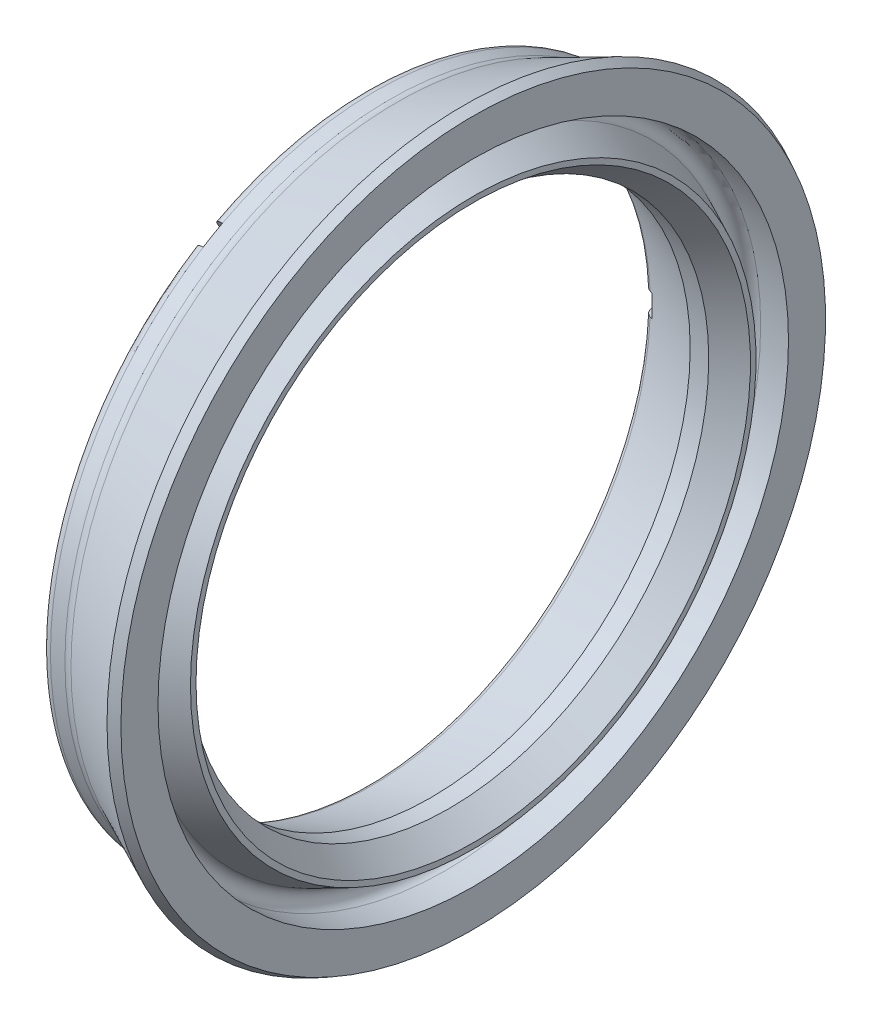
from build123d import *

# Parameters (mm, degrees)
FILLET1_R          = 1
CUT_EXTRUDE1_DEPTH = 0.1
SKETCH3_W          = 1
SKETCH3_H          = 1.2
CUT_EXTRUDE2_DEPTH = 28.834600908
CIRPATTERN1_COUNT  = 3


with BuildPart() as part:
    # Sketch1 → Revolve1 (revolve)
    with BuildSketch(Plane.XY, mode=Mode.PRIVATE) as revolve1_sk:
        with BuildLine():
            Line((0, 15.47657924), (0, 17))
            ThreePointArc((0, 17), (0.146446609, 17.353553391), (0.5, 17.5))
            Line((0.5, 17.5), (1.5, 17.5))
            Line((1.5, 17.5), (5.3, 19.25))
            Line((5.3, 19.25), (5.8, 19))
            Line((5.8, 19), (5.8, 17))
            Line((5.8, 17), (4.3, 17))
            ThreePointArc((4.3, 17), (3.811822126, 16.608084983), (4.088941212, 16.046729454))
            Line((4.088941212, 16.046729454), (5.8, 15.25))
            Line((5.8, 15.25), (5.8, 14.95))
            Line((5.8, 14.95), (4.5, 14))
            Line((4.5, 14), (3.5, 14))
            Line((3.5, 14), (0.348764329, 15))
            ThreePointArc((0.348764329, 15), (0.096504129, 15.181297879), (0, 15.47657924))
        make_face()
    revolve(revolve1_sk.sketch.rotate(Axis((0, 0, 0), (1, 0, 0)), 90), axis=Axis((0, 0, 0), (1, 0, 0)))

    # Fillet1
    fillet1_edges = [part.edges().sort_by_distance(p)[0] for p in [
        (1.5, 0, -17.5),
    ]]
    fillet(fillet1_edges, radius=FILLET1_R)

    # Sketch2 → Cut-Extrude1 (cut)
    # profile 1 of 13: a face of its own
    with BuildSketch(Plane.ZY):
        with BuildLine():
            Line((-5.513236692, 15.646736619), (-5.363557205, 15.696576363))
            add(Edge.make_bspline(
                [(-5.363557205, 15.696576363), (-5.353512255, 15.699826939), (-5.334289843, 15.70604737), (-5.30673904, 15.715099859), (-5.281364662, 15.72228272), (-5.258570361, 15.728853183), (-5.238105187, 15.733868692), (-5.220182011, 15.738282269), (-5.204518152, 15.740934727), (-5.1948641, 15.742169507), (-5.190480282, 15.742730209)],
                knots=[0, 0, 0, 0, 1.412503745, 2.703022838, 3.879057233, 4.940239887, 5.876218095, 6.697914565, 7.408734662, 8, 8, 8, 8], degree=3))
            add(Edge.make_bspline(
                [(-5.190480282, 15.742730209), (-5.184555288, 15.743203754), (-5.172822615, 15.744141467), (-5.155334297, 15.743794102), (-5.13832217, 15.741943867), (-5.121723228, 15.739167961), (-5.105588102, 15.734773302), (-5.089895179, 15.728996409), (-5.074596319, 15.721869467), (-5.059739804, 15.71362487), (-5.045598172, 15.704010342), (-5.032524099, 15.693098164), (-5.0203499, 15.681188019), (-5.009401397, 15.667970954), (-4.999722953, 15.653478799), (-4.990770581, 15.638031924), (-4.983107815, 15.621303853), (-4.97885988, 15.609588993), (-4.976698231, 15.603627645)],
                knots=[0, 0, 0, 0, 1.02975508, 2.039121114, 3.025811522, 3.993908284, 4.952930606, 5.919565219, 6.888900862, 7.875417496, 8.861543025, 9.847842398, 10.823348846, 11.809648219, 12.816292897, 13.840664528, 14.901177562, 16, 16, 16, 16], degree=3))
            add(Edge.make_bspline(
                [(-4.976698231, 15.603627645), (-4.973678409, 15.59359914), (-4.967765538, 15.573963128), (-4.964063446, 15.54390869), (-4.964249386, 15.514506201), (-4.968890484, 15.485953365), (-4.977814283, 15.458720436), (-4.990531553, 15.43294728), (-5.007870572, 15.40935199), (-5.025165341, 15.391139143), (-5.041252253, 15.377645777), (-5.054949222, 15.367674162), (-5.070219401, 15.358059909), (-5.087102374, 15.348865521), (-5.105305456, 15.339655945), (-5.125177032, 15.331087185), (-5.146454789, 15.322516357), (-5.161343337, 15.317346217), (-5.169005923, 15.314685337)],
                knots=[0, 0, 0, 0, 1.27216696, 2.490927996, 3.667247005, 4.839249893, 5.994210959, 7.142185145, 8.319939347, 9.542575186, 10.188263018, 10.871976625, 11.602166358, 12.381700848, 13.209986021, 14.082954318, 15.013367326, 16, 16, 16, 16], degree=3))
            Line((-5.169005923, 15.314685337), (-4.782307205, 15.055390466))
            Line((-4.782307205, 15.055390466), (-4.875416179, 15.024300722))
            Line((-4.875416179, 15.024300722), (-5.261473872, 15.283916107))
            Line((-5.261473872, 15.283916107), (-5.304262333, 15.269653286))
            Line((-5.304262333, 15.269653286), (-5.187916179, 14.920294312))
            Line((-5.187916179, 14.920294312), (-5.263076436, 14.895294312))
            Line((-5.263076436, 14.895294312), (-5.513236692, 15.646736619))
        make_face()
        with BuildLine():
            Line((-5.413557205, 15.598178927), (-5.328461051, 15.342730209))
            Line((-5.328461051, 15.342730209), (-5.198973872, 15.384877645))
            add(Edge.make_bspline(
                [(-5.198973872, 15.384877645), (-5.192926625, 15.386929713), (-5.181260543, 15.390888474), (-5.164510314, 15.397139017), (-5.149177995, 15.403522453), (-5.135182053, 15.409955132), (-5.122528934, 15.416304245), (-5.111282356, 15.422703253), (-5.1013875, 15.429119234), (-5.090196069, 15.437762932), (-5.078266711, 15.449489769), (-5.066333554, 15.464919175), (-5.057467632, 15.482068176), (-5.05124012, 15.500328868), (-5.047686483, 15.519392357), (-5.047079556, 15.538827702), (-5.049231306, 15.558419166), (-5.05299564, 15.571086302), (-5.054903359, 15.57750585)],
                knots=[0, 0, 0, 0, 1.11744946, 2.155734408, 3.127910899, 4.023013382, 4.850760167, 5.604407998, 6.286288709, 6.912664474, 8.076087043, 9.203462662, 10.311488627, 11.43777859, 12.569023046, 13.691388168, 14.83002394, 16, 16, 16, 16], degree=3))
            add(Edge.make_bspline(
                [(-5.054903359, 15.57750585), (-5.057187423, 15.58356699), (-5.061703863, 15.595552107), (-5.071477172, 15.612070753), (-5.083626091, 15.626787638), (-5.097910813, 15.639532291), (-5.113614236, 15.650218151), (-5.130424906, 15.658421386), (-5.148216393, 15.663522682), (-5.163699372, 15.665743048), (-5.176980519, 15.66596657), (-5.188217442, 15.665054081), (-5.200726713, 15.663426778), (-5.21448505, 15.661042908), (-5.229445635, 15.657618413), (-5.245608966, 15.653231444), (-5.263085147, 15.648114458), (-5.275104362, 15.644254058), (-5.281345667, 15.64224944)],
                knots=[0, 0, 0, 0, 1.15589625, 2.285634727, 3.41141331, 4.553866835, 5.695083182, 6.796720813, 7.881224103, 8.989665977, 9.581636446, 10.251605876, 11.002340783, 11.835749139, 12.74594281, 13.74401499, 14.828518281, 16, 16, 16, 16], degree=3))
            Line((-5.281345667, 15.64224944), (-5.413557205, 15.598178927))
        make_face(mode=Mode.SUBTRACT)
    # profile 2 of 13: a face of its own
    with BuildSketch(Plane.ZY):
        Polygon((-4.846118454, 15.87339904), (-4.769035121, 15.895995193), (-4.566631275, 15.203847757), (-4.272400506, 15.28990545), (-4.25076589, 15.215866988), (-4.622079993, 15.107213142), align=None)
    # profile 3 of 13: a face of its own
    with BuildSketch(Plane.ZY):
        Polygon((-4.12826997, 15.248587983), (-4.319616124, 16.022145675), (-4.3027892, 16.026312342), (-3.642052021, 15.561408495), (-3.78852638, 16.153555931), (-3.712404585, 16.172466188), (-3.521058431, 15.398908495), (-3.538366124, 15.394581572), (-4.193173816, 15.853075162), (-4.048462277, 15.268299521), align=None)
    # profile 4 of 13: a face of its own
    with BuildSketch(Plane.ZY):
        Polygon((-3.241907405, 16.195323355), (-3.256009969, 16.271284893), (-2.827484328, 16.350772073), (-2.813381764, 16.274810534), (-2.987580482, 16.242598996), (-2.856811251, 15.537631047), (-2.936458687, 15.522727201), (-3.067227918, 16.22769515), align=None)
    # profile 5 of 13: a face of its own
    with BuildSketch(Plane.ZY):
        with BuildLine():
            Line((-2.671946245, 15.722817863), (-2.611048809, 15.773138376))
            add(Edge.make_bspline(
                [(-2.611048809, 15.773138376), (-2.603664835, 15.763773446), (-2.589494957, 15.745802101), (-2.566776036, 15.721931274), (-2.543740059, 15.702457526), (-2.520955937, 15.686685633), (-2.497768328, 15.675388744), (-2.474446557, 15.668460999), (-2.4509956, 15.665144266), (-2.435567434, 15.666735896), (-2.427875732, 15.667529402)],
                knots=[0, 0, 0, 0, 1.288691563, 2.473004974, 3.554644125, 4.544373842, 5.461179188, 6.328941456, 7.166894914, 8, 8, 8, 8], degree=3))
            add(Edge.make_bspline(
                [(-2.427875732, 15.667529402), (-2.42136949, 15.66874991), (-2.408462352, 15.671171164), (-2.389979592, 15.677740916), (-2.372430116, 15.686316454), (-2.356086022, 15.696989338), (-2.341224987, 15.709311555), (-2.328638567, 15.723241683), (-2.318159235, 15.738316488), (-2.310221146, 15.75462082), (-2.304666775, 15.771634812), (-2.30115565, 15.788892763), (-2.300342339, 15.806350962), (-2.301603415, 15.817858501), (-2.302234706, 15.823619146)],
                knots=[0, 0, 0, 0, 1.06857833, 2.119854591, 3.158575294, 4.219486941, 5.267496156, 6.269950155, 7.244691588, 8.225494358, 9.189314404, 10.130792963, 11.064279774, 12, 12, 12, 12], degree=3))
            add(Edge.make_bspline(
                [(-2.302234706, 15.823619146), (-2.303549995, 15.830205328), (-2.306199835, 15.843474155), (-2.314582789, 15.862424986), (-2.326072331, 15.880607614), (-2.335826119, 15.891539083), (-2.340856501, 15.897176838)],
                knots=[0, 0, 0, 0, 0.952754949, 1.919464252, 2.926992132, 4, 4, 4, 4], degree=3))
            add(Edge.make_bspline(
                [(-2.340856501, 15.897176838), (-2.344863277, 15.901239094), (-2.353286251, 15.909778697), (-2.367658182, 15.922060743), (-2.384062282, 15.934580606), (-2.402134354, 15.947925525), (-2.422660902, 15.960990234), (-2.444801296, 15.975088902), (-2.469262455, 15.989058739), (-2.486250425, 15.998428138), (-2.495023168, 16.003266581)],
                knots=[0, 0, 0, 0, 0.728852602, 1.532181004, 2.412844785, 3.36587699, 4.401500804, 5.520844961, 6.719741597, 8, 8, 8, 8], degree=3))
            add(Edge.make_bspline(
                [(-2.495023168, 16.003266581), (-2.503738321, 16.008059633), (-2.5204188, 16.017233358), (-2.544175594, 16.030597424), (-2.565240377, 16.043308299), (-2.583988445, 16.054796313), (-2.600067731, 16.065523805), (-2.613818182, 16.075081253), (-2.624961543, 16.083798813), (-2.631171367, 16.089709592), (-2.633965476, 16.092369146)],
                knots=[0, 0, 0, 0, 1.44282243, 2.761508766, 3.953561538, 5.011511632, 5.950700909, 6.756925759, 7.440679047, 8, 8, 8, 8], degree=3))
            add(Edge.make_bspline(
                [(-2.633965476, 16.092369146), (-2.638053625, 16.096516423), (-2.646092205, 16.104671266), (-2.656580727, 16.117983486), (-2.666216962, 16.13144091), (-2.67435233, 16.145586436), (-2.681295329, 16.160208239), (-2.686866565, 16.175289037), (-2.691333969, 16.190810165), (-2.693146221, 16.20142861), (-2.694061629, 16.206792222)],
                knots=[0, 0, 0, 0, 1.061424028, 2.087091596, 3.087310901, 4.078375562, 5.059087508, 6.036453711, 7.008169225, 8, 8, 8, 8], degree=3))
            add(Edge.make_bspline(
                [(-2.694061629, 16.206792222), (-2.695035966, 16.215220281), (-2.696963121, 16.231890271), (-2.69587995, 16.256807547), (-2.691722405, 16.281080108), (-2.684143757, 16.304403877), (-2.673628887, 16.326565175), (-2.660016361, 16.346915354), (-2.643610149, 16.365381548), (-2.62459858, 16.381832925), (-2.603337723, 16.395758073), (-2.580621642, 16.407414205), (-2.55620613, 16.415573335), (-2.539298543, 16.418789752), (-2.530760347, 16.420414017)],
                knots=[0, 0, 0, 0, 1.01690912, 2.011360742, 2.981036102, 3.964348783, 4.94504557, 5.915885858, 6.892319502, 7.901316391, 8.923727641, 9.935815627, 10.957603584, 12, 12, 12, 12], degree=3))
            add(Edge.make_bspline(
                [(-2.530760347, 16.420414017), (-2.521531443, 16.421467195), (-2.503259914, 16.423552294), (-2.475706936, 16.422240471), (-2.44859497, 16.417634896), (-2.42641462, 16.410621463), (-2.408719005, 16.402978082), (-2.394985559, 16.395660783), (-2.380632683, 16.387237248), (-2.366161684, 16.377028854), (-2.351119868, 16.365623351), (-2.335868844, 16.352623516), (-2.320074464, 16.338327899), (-2.30967613, 16.328092167), (-2.30431804, 16.322817863)],
                knots=[0, 0, 0, 0, 1.298473385, 2.57073777, 3.845548619, 5.139168525, 5.81567184, 6.541458679, 7.316028279, 8.143643809, 9.018551655, 9.957783479, 10.94767955, 12, 12, 12, 12], degree=3))
            Line((-2.30431804, 16.322817863), (-2.361369322, 16.264164017))
            add(Edge.make_bspline(
                [(-2.361369322, 16.264164017), (-2.365661711, 16.268367635), (-2.373954653, 16.276489069), (-2.386517005, 16.287644625), (-2.398296917, 16.297792595), (-2.409569373, 16.306608312), (-2.420156371, 16.314381041), (-2.430190894, 16.320946982), (-2.439641568, 16.326311009), (-2.451428986, 16.331630833), (-2.465933418, 16.3364649), (-2.483702102, 16.339883238), (-2.501847861, 16.340985833), (-2.513942085, 16.339560283), (-2.520023168, 16.338843505)],
                knots=[0, 0, 0, 0, 1.18295961, 2.285490489, 3.307868454, 4.244373529, 5.102887989, 5.893629838, 6.604791931, 7.240352481, 8.437955826, 9.605709123, 10.796129332, 12, 12, 12, 12], degree=3))
            add(Edge.make_bspline(
                [(-2.520023168, 16.338843505), (-2.527573944, 16.337343699), (-2.542203826, 16.334437776), (-2.562430684, 16.325847748), (-2.579792941, 16.313737107), (-2.594041792, 16.29861914), (-2.604972854, 16.281369893), (-2.612063031, 16.262622869), (-2.614897015, 16.242629089), (-2.613625401, 16.229225532), (-2.612971886, 16.222337094)],
                knots=[0, 0, 0, 0, 1.107297554, 2.145426364, 3.140622782, 4.13715817, 5.119648922, 6.064816567, 7.005458845, 8, 8, 8, 8], degree=3))
            add(Edge.make_bspline(
                [(-2.612971886, 16.222337094), (-2.612202231, 16.21809835), (-2.610662448, 16.209618254), (-2.606814714, 16.197213897), (-2.601368164, 16.185351393), (-2.594976, 16.173516774), (-2.586457222, 16.161989305), (-2.575600249, 16.150626296), (-2.562885954, 16.138664636), (-2.553063826, 16.131320527), (-2.547907783, 16.127465299)],
                knots=[0, 0, 0, 0, 0.872587305, 1.745711669, 2.622853498, 3.514505474, 4.467220835, 5.516635358, 6.696378744, 8, 8, 8, 8], degree=3))
            add(Edge.make_bspline(
                [(-2.547907783, 16.127465299), (-2.546047053, 16.126222555), (-2.541534676, 16.123208829), (-2.533339887, 16.118357195), (-2.522855336, 16.112053572), (-2.509728024, 16.104894326), (-2.494226774, 16.096420598), (-2.476313834, 16.086631352), (-2.455953408, 16.075747509), (-2.441555207, 16.068162373), (-2.433965476, 16.064164017)],
                knots=[0, 0, 0, 0, 0.411805356, 0.998651362, 1.752449467, 2.663563296, 3.750432432, 5.004451759, 6.420955217, 8, 8, 8, 8], degree=3))
            add(Edge.make_bspline(
                [(-2.433965476, 16.064164017), (-2.42480239, 16.059248117), (-2.407032645, 16.049714832), (-2.381710327, 16.035027365), (-2.358611861, 16.02033796), (-2.337379965, 16.006184673), (-2.31834248, 15.992053633), (-2.301245517, 15.97836834), (-2.286419291, 15.96465328), (-2.269635476, 15.947065178), (-2.252014725, 15.924758049), (-2.235400893, 15.896792025), (-2.223485021, 15.867886026), (-2.219450227, 15.847903535), (-2.217459065, 15.838042222)],
                knots=[0, 0, 0, 0, 1.151684521, 2.233433325, 3.241286996, 4.183214275, 5.058889084, 5.866497739, 6.607584165, 7.293908213, 8.558010172, 9.746242845, 10.887776133, 12, 12, 12, 12], degree=3))
            add(Edge.make_bspline(
                [(-2.217459065, 15.838042222), (-2.216549013, 15.830949187), (-2.214754323, 15.816961203), (-2.214899176, 15.796000205), (-2.216896046, 15.775468433), (-2.221326976, 15.755346658), (-2.227726065, 15.735574181), (-2.236342807, 15.716234243), (-2.246919593, 15.697231844), (-2.259707837, 15.67902601), (-2.273981818, 15.661782765), (-2.28969544, 15.646194931), (-2.306650535, 15.632518283), (-2.324658381, 15.620512782), (-2.344016623, 15.610623823), (-2.364426961, 15.602393465), (-2.386070419, 15.596072441), (-2.401029363, 15.593406078), (-2.408644963, 15.592048633)],
                knots=[0, 0, 0, 0, 0.991030523, 1.954384536, 2.900425006, 3.848089382, 4.80655723, 5.778678344, 6.780592826, 7.818712427, 8.860501939, 9.882306608, 10.883398612, 11.878162364, 12.879089792, 13.893261398, 14.927459153, 16, 16, 16, 16], degree=3))
            add(Edge.make_bspline(
                [(-2.408644963, 15.592048633), (-2.414565839, 15.591264609), (-2.426320435, 15.589708102), (-2.443950387, 15.58896861), (-2.461359248, 15.5894109), (-2.478537086, 15.591241681), (-2.495533623, 15.594060196), (-2.512250064, 15.598250472), (-2.528681678, 15.603752054), (-2.544935594, 15.610495863), (-2.561116923, 15.618712715), (-2.577115475, 15.628744489), (-2.593148277, 15.640273379), (-2.609085601, 15.653517487), (-2.624910152, 15.668463051), (-2.640757494, 15.685019016), (-2.656716479, 15.703096912), (-2.666784554, 15.716134015), (-2.671946245, 15.722817863)],
                knots=[0, 0, 0, 0, 0.922784599, 1.831985782, 2.724079254, 3.612228186, 4.49999322, 5.385143329, 6.272908363, 7.176090771, 8.102966744, 9.074482647, 10.091930632, 11.153356952, 12.274903502, 13.454519411, 14.694985505, 16, 16, 16, 16], degree=3))
        make_face()
    # profile 6 of 13: a face of its own
    with BuildSketch(Plane.ZY):
        with BuildLine():
            Line((-2.117661149, 15.806186695), (-2.055321405, 15.854263618))
            add(Edge.make_bspline(
                [(-2.055321405, 15.854263618), (-2.048280453, 15.844618834), (-2.034834765, 15.826200762), (-2.012842327, 15.80188774), (-1.990940117, 15.78138578), (-1.968588104, 15.765244166), (-1.946041967, 15.752967859), (-1.923118694, 15.745249235), (-1.899879014, 15.74134505), (-1.884496621, 15.742371529), (-1.876795764, 15.742885413)],
                knots=[0, 0, 0, 0, 1.295937375, 2.474774577, 3.554503821, 4.547811905, 5.461281618, 6.330796038, 7.164349725, 8, 8, 8, 8], degree=3))
            add(Edge.make_bspline(
                [(-1.876795764, 15.742885413), (-1.870299872, 15.743847533), (-1.857395027, 15.745758895), (-1.838669287, 15.751443733), (-1.820982162, 15.7595718), (-1.804312164, 15.769615258), (-1.789238902, 15.781514293), (-1.776075983, 15.794836816), (-1.765400832, 15.809658231), (-1.756915355, 15.825515075), (-1.750641677, 15.842167283), (-1.74679151, 15.859205865), (-1.745235727, 15.876476663), (-1.746081166, 15.887919179), (-1.746507303, 15.893686695)],
                knots=[0, 0, 0, 0, 1.066071586, 2.117875347, 3.166773517, 4.222296185, 5.272988879, 6.279730542, 7.255571164, 8.230368746, 9.194556658, 10.138006072, 11.061475576, 12, 12, 12, 12], degree=3))
            add(Edge.make_bspline(
                [(-1.746507303, 15.893686695), (-1.747546535, 15.900266961), (-1.749652107, 15.913599125), (-1.757412602, 15.93271783), (-1.768056068, 15.95140423), (-1.777507482, 15.962577002), (-1.782404738, 15.968366182)],
                knots=[0, 0, 0, 0, 0.946802397, 1.918300116, 2.921365801, 4, 4, 4, 4], degree=3))
            add(Edge.make_bspline(
                [(-1.782404738, 15.968366182), (-1.786243701, 15.972539976), (-1.794307818, 15.98130744), (-1.80825753, 15.993840439), (-1.823968456, 16.006992642), (-1.841652962, 16.020641632), (-1.861383962, 16.034661778), (-1.883010314, 16.049304419), (-1.906768239, 16.064135078), (-1.923358216, 16.074006526), (-1.931923969, 16.079103362)],
                knots=[0, 0, 0, 0, 0.728542829, 1.530375755, 2.407762283, 3.36228049, 4.400731542, 5.518615085, 6.718808931, 8, 8, 8, 8], degree=3))
            add(Edge.make_bspline(
                [(-1.931923969, 16.079103362), (-1.940488807, 16.0841482), (-1.956845479, 16.093782564), (-1.979945154, 16.108021246), (-2.000446029, 16.12137718), (-2.018637335, 16.133497174), (-2.034310709, 16.1447225), (-2.047662566, 16.154747038), (-2.058549242, 16.163773075), (-2.064499597, 16.169922594), (-2.067180379, 16.172693105)],
                knots=[0, 0, 0, 0, 1.446920755, 2.763252082, 3.949501576, 5.008421877, 5.944891621, 6.75515232, 7.439165103, 8, 8, 8, 8], degree=3))
            add(Edge.make_bspline(
                [(-2.067180379, 16.172693105), (-2.071025067, 16.176975115), (-2.078610816, 16.18542372), (-2.088942131, 16.198707029), (-2.09778652, 16.212578429), (-2.105330323, 16.226919629), (-2.111748329, 16.241634492), (-2.116965834, 16.256771647), (-2.12062814, 16.27241688), (-2.122171735, 16.283043225), (-2.12294961, 16.288398234)],
                knots=[0, 0, 0, 0, 1.056223689, 2.083978464, 3.085001729, 4.071949556, 5.055676999, 6.029383188, 7.006933163, 8, 8, 8, 8], degree=3))
            add(Edge.make_bspline(
                [(-2.12294961, 16.288398234), (-2.123588664, 16.296833207), (-2.124847351, 16.313446831), (-2.123052801, 16.338275996), (-2.117833002, 16.362220234), (-2.109716522, 16.385316708), (-2.098256986, 16.406835427), (-2.084296827, 16.426843718), (-2.067195767, 16.444559268), (-2.047684029, 16.460198068), (-2.026110798, 16.47348529), (-2.002954076, 16.483910532), (-1.978454471, 16.491497874), (-1.961510634, 16.494013472), (-1.952917559, 16.495289259)],
                knots=[0, 0, 0, 0, 1.018300889, 2.005657442, 2.986593979, 3.963827857, 4.945629855, 5.915373283, 6.89419573, 7.90145137, 8.921500277, 9.938437255, 10.954477535, 12, 12, 12, 12], degree=3))
            add(Edge.make_bspline(
                [(-1.952917559, 16.495289259), (-1.943736652, 16.49599444), (-1.925471443, 16.497397381), (-1.898077746, 16.495513793), (-1.871346123, 16.48944395), (-1.849409435, 16.48198952), (-1.832081021, 16.473647261), (-1.818502621, 16.466132782), (-1.804830694, 16.456877968), (-1.790593951, 16.446492259), (-1.776293985, 16.43433265), (-1.761331467, 16.421142827), (-1.746265451, 16.406262526), (-1.73627459, 16.395744864), (-1.731122687, 16.39032131)],
                knots=[0, 0, 0, 0, 1.294010184, 2.574404483, 3.843218279, 5.14056116, 5.822759798, 6.545926181, 7.321080821, 8.143029026, 9.023209428, 9.959720845, 10.947906555, 12, 12, 12, 12], degree=3))
            Line((-1.731122687, 16.39032131), (-1.78993679, 16.333911054))
            add(Edge.make_bspline(
                [(-1.78993679, 16.333911054), (-1.794081602, 16.338205836), (-1.80210894, 16.346523623), (-1.814062465, 16.358195549), (-1.82551651, 16.368585541), (-1.836131984, 16.378072533), (-1.846688806, 16.38579407), (-1.856345949, 16.392760056), (-1.865514201, 16.398470631), (-1.877042502, 16.404176599), (-1.89129978, 16.409569995), (-1.908851343, 16.413688265), (-1.926902633, 16.415170582), (-1.938978944, 16.414205244), (-1.945064995, 16.413718746)],
                knots=[0, 0, 0, 0, 1.181060523, 2.28738276, 3.304899168, 4.24162624, 5.102067028, 5.89096869, 6.598007516, 7.236188765, 8.433784188, 9.605584328, 10.793295843, 12, 12, 12, 12], degree=3))
            add(Edge.make_bspline(
                [(-1.945064995, 16.413718746), (-1.95266314, 16.412495036), (-1.967289273, 16.410139441), (-1.987683707, 16.402241705), (-2.005480047, 16.390922837), (-2.020126232, 16.376205864), (-2.031781885, 16.359562118), (-2.039305031, 16.341059386), (-2.043053467, 16.321331527), (-2.04215691, 16.307906224), (-2.04169961, 16.30105849)],
                knots=[0, 0, 0, 0, 1.111055437, 2.138738395, 3.139952462, 4.140092008, 5.124094357, 6.059898599, 7.010428353, 8, 8, 8, 8], degree=3))
            add(Edge.make_bspline(
                [(-2.04169961, 16.30105849), (-2.041025201, 16.296824725), (-2.039679901, 16.288379286), (-2.036336179, 16.275916962), (-2.031387491, 16.263931014), (-2.025504418, 16.251931477), (-2.017371415, 16.24016687), (-2.007044173, 16.228421613), (-1.994549969, 16.216265159), (-1.98513795, 16.208519535), (-1.980161149, 16.204423875)],
                knots=[0, 0, 0, 0, 0.872436595, 1.740320901, 2.618700777, 3.508648899, 4.455692365, 5.519574373, 6.688423081, 8, 8, 8, 8], degree=3))
            add(Edge.make_bspline(
                [(-1.980161149, 16.204423875), (-1.978352156, 16.203131328), (-1.973939112, 16.199978154), (-1.966019954, 16.194807668), (-1.955683562, 16.18838411), (-1.943017644, 16.180699389), (-1.92794757, 16.171734202), (-1.910475479, 16.161484249), (-1.890602347, 16.149947637), (-1.876532078, 16.141864547), (-1.869103456, 16.137596952)],
                knots=[0, 0, 0, 0, 0.411533696, 1.003937973, 1.750243138, 2.664330048, 3.74629903, 4.996209984, 6.414101526, 8, 8, 8, 8], degree=3))
            add(Edge.make_bspline(
                [(-1.869103456, 16.137596952), (-1.860146584, 16.132367816), (-1.84283177, 16.122259207), (-1.818258285, 16.106604768), (-1.79565841, 16.091445797), (-1.775049694, 16.076580743), (-1.756680534, 16.061830131), (-1.74018254, 16.047538862), (-1.725735765, 16.033556199), (-1.709729062, 16.015366686), (-1.69304932, 15.992528499), (-1.677456405, 15.964152115), (-1.666397725, 15.935015637), (-1.66316817, 15.914973961), (-1.661571405, 15.9050649)],
                knots=[0, 0, 0, 0, 1.153800331, 2.230448103, 3.240890569, 4.181207033, 5.056467584, 5.860992655, 6.609076037, 7.291168816, 8.554828241, 9.746310005, 10.885724426, 12, 12, 12, 12], degree=3))
            add(Edge.make_bspline(
                [(-1.661571405, 15.9050649), (-1.660948231, 15.898020223), (-1.659712455, 15.8840504), (-1.660372168, 15.863187863), (-1.663328432, 15.842793249), (-1.668259756, 15.822901971), (-1.675435156, 15.803491763), (-1.684600136, 15.784542493), (-1.695881014, 15.765994996), (-1.709247811, 15.748331234), (-1.724036158, 15.731646017), (-1.740237462, 15.716774826), (-1.757465115, 15.70365169), (-1.775913085, 15.692525619), (-1.795453942, 15.683238933), (-1.816116396, 15.675828563), (-1.837864814, 15.670332171), (-1.852839612, 15.668178566), (-1.86044961, 15.667084131)],
                knots=[0, 0, 0, 0, 0.984887516, 1.95306374, 2.900528537, 3.851991154, 4.803424651, 5.778927765, 6.781105114, 7.82326322, 8.861826059, 9.883850431, 10.882843399, 11.874794749, 12.880366839, 13.892858464, 14.929177954, 16, 16, 16, 16], degree=3))
            add(Edge.make_bspline(
                [(-1.86044961, 15.667084131), (-1.866373784, 15.666509072), (-1.878096605, 15.665371138), (-1.895666548, 15.665325965), (-1.912967175, 15.666203798), (-1.930005479, 15.668468256), (-1.946722965, 15.671995581), (-1.963164094, 15.676842395), (-1.979309939, 15.682960828), (-1.99531522, 15.690192037), (-2.011141146, 15.698867663), (-2.026668232, 15.709369434), (-2.042089963, 15.721477247), (-2.057521828, 15.735154889), (-2.072862345, 15.750482989), (-2.087908353, 15.767621518), (-2.103018732, 15.786202632), (-2.112697239, 15.799411919), (-2.117661149, 15.806186695)],
                knots=[0, 0, 0, 0, 0.924478986, 1.829369331, 2.7273027, 3.61489247, 4.497343069, 5.37994984, 6.275770195, 7.178525643, 8.107392238, 9.076702533, 10.088008949, 11.15243451, 12.279469531, 13.455575636, 14.695016177, 16, 16, 16, 16], degree=3))
        make_face()
    # profile 7 of 13: a face of its own
    with BuildSketch(Plane.ZY):
        with BuildLine():
            Line((-0.846522684, 16.323067635), (-0.922804736, 16.319862507))
            add(Edge.make_bspline(
                [(-0.922804736, 16.319862507), (-0.922766667, 16.329485727), (-0.9226918, 16.348411249), (-0.919574274, 16.376206981), (-0.914132603, 16.402754965), (-0.906401502, 16.428081631), (-0.896456041, 16.452193621), (-0.884240031, 16.475116556), (-0.86950791, 16.496710438), (-0.85262081, 16.516912095), (-0.833970245, 16.535385419), (-0.814075057, 16.551838033), (-0.792947079, 16.565920488), (-0.770503351, 16.57749588), (-0.746865772, 16.586794259), (-0.722035715, 16.593890774), (-0.695992273, 16.598618264), (-0.67816563, 16.599741299), (-0.669118838, 16.600311224)],
                knots=[0, 0, 0, 0, 1.095762027, 2.154982024, 3.180280664, 4.179452284, 5.167271325, 6.147486722, 7.133297637, 8.140076897, 9.142801007, 10.119988705, 11.07706948, 12.029786421, 12.991557898, 13.966316665, 14.967931975, 16, 16, 16, 16], degree=3))
            add(Edge.make_bspline(
                [(-0.669118838, 16.600311224), (-0.660194002, 16.600475992), (-0.642685753, 16.600799224), (-0.616931403, 16.598470462), (-0.59239096, 16.594061866), (-0.56904743, 16.587309502), (-0.547000015, 16.578086986), (-0.52607553, 16.566693894), (-0.506411413, 16.552983646), (-0.488265162, 16.537127473), (-0.471760776, 16.519795018), (-0.45703426, 16.501458733), (-0.444462834, 16.4821366), (-0.434026705, 16.461882936), (-0.425641172, 16.440789648), (-0.41937714, 16.418836357), (-0.415122984, 16.396025259), (-0.414051502, 16.380456779), (-0.413509864, 16.372586865)],
                knots=[0, 0, 0, 0, 1.120278774, 2.197700727, 3.241109536, 4.247347955, 5.242750095, 6.23641018, 7.233867188, 8.246725009, 9.257358916, 10.235867935, 11.195969151, 12.147052259, 13.092535686, 14.041629474, 15.010037753, 16, 16, 16, 16], degree=3))
            add(Edge.make_bspline(
                [(-0.413509864, 16.372586865), (-0.413421126, 16.36145855), (-0.413244858, 16.339353496), (-0.41833281, 16.306612058), (-0.427154162, 16.274724246), (-0.438141118, 16.248811221), (-0.449438092, 16.227862583), (-0.459844194, 16.210681898), (-0.471721699, 16.191948137), (-0.485889297, 16.172055334), (-0.501644223, 16.150597057), (-0.519539392, 16.127901828), (-0.539067258, 16.10368073), (-0.552852701, 16.087201624), (-0.559984223, 16.078676609)],
                knots=[0, 0, 0, 0, 1.187312782, 2.358453232, 3.525763252, 4.715063285, 5.35594674, 6.067515513, 6.860669717, 7.725170813, 8.67601155, 9.704650471, 10.812563774, 12, 12, 12, 12], degree=3))
            Line((-0.559984223, 16.078676609), (-0.748926531, 15.856721481))
            Line((-0.748926531, 15.856721481), (-0.381618838, 15.872106096))
            Line((-0.381618838, 15.872106096), (-0.37841371, 15.795343276))
            Line((-0.37841371, 15.795343276), (-0.918798326, 15.772747122))
            Line((-0.918798326, 15.772747122), (-0.628573967, 16.113772763))
            add(Edge.make_bspline(
                [(-0.628573967, 16.113772763), (-0.621487747, 16.122023266), (-0.607872588, 16.137875427), (-0.588845442, 16.161145296), (-0.571656022, 16.18268352), (-0.556245745, 16.202367863), (-0.543065693, 16.220631406), (-0.531700465, 16.237061505), (-0.522105373, 16.251760772), (-0.5123658, 16.269175235), (-0.502759976, 16.290000214), (-0.49523315, 16.315529798), (-0.490797479, 16.341444525), (-0.490874969, 16.358894776), (-0.49091371, 16.367618917)],
                knots=[0, 0, 0, 0, 1.322307332, 2.540624395, 3.654369914, 4.672896342, 5.57970304, 6.392220212, 7.102073265, 7.712736129, 8.81735399, 9.881771995, 10.941005487, 12, 12, 12, 12], degree=3))
            add(Edge.make_bspline(
                [(-0.49091371, 16.367618917), (-0.491272136, 16.373135348), (-0.491976621, 16.383977863), (-0.49513637, 16.399873301), (-0.499789476, 16.415107359), (-0.505885011, 16.429719936), (-0.513447794, 16.443715179), (-0.522911118, 16.456819428), (-0.53358352, 16.469510709), (-0.545733297, 16.481299011), (-0.558947074, 16.491944884), (-0.572891754, 16.501329443), (-0.587595791, 16.509023755), (-0.60285579, 16.515342288), (-0.618814928, 16.520013789), (-0.635416448, 16.522983929), (-0.652630265, 16.524708033), (-0.66430755, 16.524470416), (-0.670240633, 16.524349686)],
                knots=[0, 0, 0, 0, 1.00111568, 1.967687352, 2.929445704, 3.884306838, 4.83325851, 5.805777181, 6.808764107, 7.835858298, 8.868687184, 9.88111737, 10.877304306, 11.871654344, 12.870519902, 13.884661799, 14.925222936, 16, 16, 16, 16], degree=3))
            add(Edge.make_bspline(
                [(-0.670240633, 16.524349686), (-0.676447604, 16.52391794), (-0.688658122, 16.523068599), (-0.70656288, 16.520049359), (-0.723513969, 16.515238316), (-0.739561944, 16.508852732), (-0.754907612, 16.501279291), (-0.769151782, 16.491639663), (-0.782735265, 16.480772655), (-0.795148714, 16.468219627), (-0.806617139, 16.454481574), (-0.816537308, 16.439258239), (-0.825259681, 16.422953545), (-0.832254656, 16.405273524), (-0.838092897, 16.386485937), (-0.842275655, 16.366404456), (-0.845495987, 16.345170576), (-0.846174723, 16.330558603), (-0.846522684, 16.323067635)],
                knots=[0, 0, 0, 0, 1.002496923, 1.972138307, 2.920677001, 3.836852859, 4.753311893, 5.672718852, 6.603266658, 7.553055075, 8.513284666, 9.482849589, 10.47658183, 11.488683513, 12.542695723, 13.643802067, 14.792072555, 16, 16, 16, 16], degree=3))
        make_face()
    # profile 8 of 13: a face of its own
    with BuildSketch(Plane.ZY):
        with BuildLine():
            add(Edge.make_bspline(
                [(0.081182045, 16.242046008), (0.087730284, 16.238631618), (0.100501538, 16.231972418), (0.118690614, 16.221249943), (0.135313471, 16.209949151), (0.150831314, 16.198603811), (0.164971508, 16.186779434), (0.177575945, 16.174428998), (0.188955973, 16.161860782), (0.198882095, 16.148861962), (0.2076128, 16.13546707), (0.215158431, 16.121640951), (0.221608078, 16.107413903), (0.226719607, 16.092630628), (0.230930302, 16.077508282), (0.233827583, 16.061851601), (0.235385736, 16.045763751), (0.235680322, 16.034890997), (0.23582948, 16.029385752)],
                knots=[0, 0, 0, 0, 1.272397273, 2.481599622, 3.635517121, 4.734568067, 5.792894095, 6.808321871, 7.773003508, 8.711915296, 9.623354172, 10.525449501, 11.423591555, 12.311487226, 13.218079475, 14.126165749, 15.051214107, 16, 16, 16, 16], degree=3))
            add(Edge.make_bspline(
                [(0.23582948, 16.029385752), (0.235653156, 16.021683413), (0.235304143, 16.006437594), (0.232264147, 15.983935626), (0.227712609, 15.962081504), (0.221065863, 15.940880021), (0.212445659, 15.920448164), (0.201822383, 15.900768444), (0.189796964, 15.881518316), (0.18013931, 15.869673882), (0.175252557, 15.863680624)],
                knots=[0, 0, 0, 0, 1.025265484, 2.029385089, 3.018602448, 3.995076438, 4.983346944, 5.966715145, 6.97116228, 8, 8, 8, 8], degree=3))
            add(Edge.make_bspline(
                [(0.175252557, 15.863680624), (0.168889935, 15.856687761), (0.156243314, 15.842788448), (0.134578645, 15.824742549), (0.110802214, 15.809576973), (0.085006024, 15.797217683), (0.057259029, 15.787598058), (0.027567143, 15.780685482), (-0.004127521, 15.77672607), (-0.025911629, 15.77615373), (-0.037087186, 15.775860111)],
                knots=[0, 0, 0, 0, 0.954267603, 1.896743057, 2.838368354, 3.796610408, 4.779680527, 5.799409237, 6.871065594, 8, 8, 8, 8], degree=3))
            add(Edge.make_bspline(
                [(-0.037087186, 15.775860111), (-0.047833104, 15.776123534), (-0.068743567, 15.77663613), (-0.099179654, 15.780109143), (-0.127550641, 15.786195512), (-0.154021491, 15.794525709), (-0.178432621, 15.805362332), (-0.200714473, 15.818849968), (-0.221188523, 15.834445727), (-0.239233432, 15.852597516), (-0.255253647, 15.872039315), (-0.269326345, 15.892096826), (-0.281023277, 15.912771879), (-0.290926614, 15.933756192), (-0.298507876, 15.955343884), (-0.303758667, 15.977423887), (-0.307093367, 15.999957634), (-0.307537055, 16.015164869), (-0.307760263, 16.022815239)],
                knots=[0, 0, 0, 0, 1.256902934, 2.445805442, 3.576955095, 4.645999104, 5.686449165, 6.692658513, 7.68621702, 8.689161843, 9.678783111, 10.630372946, 11.551080876, 12.453998257, 13.34127905, 14.221779781, 15.105423033, 16, 16, 16, 16], degree=3))
            add(Edge.make_bspline(
                [(-0.307760263, 16.022815239), (-0.307628176, 16.028428769), (-0.307367125, 16.039523084), (-0.305560303, 16.055913788), (-0.302655512, 16.07186719), (-0.298710493, 16.087442217), (-0.293363973, 16.10252548), (-0.286908628, 16.117188445), (-0.279381325, 16.131447668), (-0.270677058, 16.145381126), (-0.260550881, 16.158793586), (-0.249084904, 16.171912671), (-0.236049963, 16.184534812), (-0.221591069, 16.196814223), (-0.20587346, 16.208968731), (-0.188488882, 16.220341469), (-0.169898192, 16.231737576), (-0.156685528, 16.238550907), (-0.149907699, 16.242046008)],
                knots=[0, 0, 0, 0, 0.941657376, 1.861047343, 2.762797495, 3.66048619, 4.553285746, 5.444104102, 6.34607688, 7.256116206, 8.197091036, 9.162375105, 10.176350973, 11.237807142, 12.343728897, 13.50695164, 14.721116704, 16, 16, 16, 16], degree=3))
            add(Edge.make_bspline(
                [(-0.149907699, 16.242046008), (-0.159185728, 16.247105384), (-0.177150588, 16.256901751), (-0.200937888, 16.274901021), (-0.221370031, 16.294395379), (-0.237885395, 16.315796475), (-0.250884761, 16.33843576), (-0.2598033, 16.36217159), (-0.265836782, 16.386563844), (-0.266434456, 16.403228118), (-0.266734622, 16.41159729)],
                knots=[0, 0, 0, 0, 1.166880483, 2.259407225, 3.286803203, 4.280235371, 5.237608625, 6.161067461, 7.076446754, 8, 8, 8, 8], degree=3))
            add(Edge.make_bspline(
                [(-0.266734622, 16.41159729), (-0.266360811, 16.420122446), (-0.265609385, 16.437259497), (-0.259533198, 16.462769468), (-0.249631468, 16.487824683), (-0.236163812, 16.512303703), (-0.219389591, 16.535378038), (-0.199264666, 16.556073111), (-0.176269627, 16.57420145), (-0.150519257, 16.589418861), (-0.122808118, 16.601803697), (-0.093570238, 16.610347337), (-0.063315039, 16.615932735), (-0.042721275, 16.616565113), (-0.032279494, 16.616885752)],
                knots=[0, 0, 0, 0, 0.888701115, 1.786444228, 2.72001202, 3.692817113, 4.693886446, 5.687152267, 6.695133018, 7.739871481, 8.800368666, 9.853104506, 10.91144658, 12, 12, 12, 12], degree=3))
            add(Edge.make_bspline(
                [(-0.032279494, 16.616885752), (-0.022107193, 16.616555159), (-0.002048575, 16.615903268), (0.027435911, 16.610466267), (0.055647311, 16.601385234), (0.08248834, 16.589065869), (0.107478481, 16.573891711), (0.129559009, 16.555514368), (0.149063599, 16.534910585), (0.165197175, 16.511843247), (0.178491549, 16.487458289), (0.187748898, 16.46194457), (0.193680778, 16.435853356), (0.194428975, 16.418198955), (0.194803839, 16.4093537)],
                knots=[0, 0, 0, 0, 1.072916533, 2.115669174, 3.151510826, 4.193348718, 5.225979165, 6.227137561, 7.216255879, 8.211077061, 9.189680878, 10.138522389, 11.067357538, 12, 12, 12, 12], degree=3))
            add(Edge.make_bspline(
                [(0.194803839, 16.4093537), (0.19447594, 16.40067332), (0.193831964, 16.383625547), (0.188414835, 16.35877377), (0.179291792, 16.335500162), (0.166835983, 16.31354063), (0.150601586, 16.29329343), (0.130805304, 16.274501094), (0.107604966, 16.257009248), (0.090173906, 16.247138079), (0.081182045, 16.242046008)],
                knots=[0, 0, 0, 0, 0.975232327, 1.915300861, 2.843280834, 3.77672583, 4.742871857, 5.749627742, 6.839139064, 8, 8, 8, 8], degree=3))
        make_face()
        with BuildLine():
            add(Edge.make_bspline(
                [(-0.036285904, 16.53483447), (-0.041897517, 16.534685569), (-0.052876285, 16.534394254), (-0.068974267, 16.53287228), (-0.084282237, 16.529911545), (-0.098960134, 16.525971268), (-0.11280672, 16.520648299), (-0.126010047, 16.514386583), (-0.138345404, 16.506773768), (-0.149961702, 16.498234065), (-0.160419022, 16.488841401), (-0.169700062, 16.479055408), (-0.177409346, 16.46868389), (-0.183955885, 16.457984836), (-0.188705946, 16.446640705), (-0.192263501, 16.434999293), (-0.194668391, 16.422913491), (-0.194848594, 16.414653717), (-0.19493975, 16.410475495)],
                knots=[0, 0, 0, 0, 1.203892937, 2.355340988, 3.463153438, 4.544400666, 5.610487187, 6.640501085, 7.674077295, 8.714426146, 9.728707835, 10.68524104, 11.601827946, 12.495867327, 13.368432065, 14.231010473, 15.105153427, 16, 16, 16, 16], degree=3))
            add(Edge.make_bspline(
                [(-0.19493975, 16.410475495), (-0.194782638, 16.406297093), (-0.194472161, 16.39803997), (-0.192070989, 16.385846629), (-0.188492279, 16.373864541), (-0.182857842, 16.362378618), (-0.176099818, 16.350990422), (-0.167758909, 16.339984574), (-0.15781856, 16.329322772), (-0.146612288, 16.319095699), (-0.134403936, 16.309518839), (-0.121470441, 16.301204969), (-0.107974122, 16.294248601), (-0.09405365, 16.288459023), (-0.079567147, 16.283958466), (-0.064603382, 16.280765632), (-0.049159838, 16.278781176), (-0.038695706, 16.278544142), (-0.033401289, 16.278424213)],
                knots=[0, 0, 0, 0, 0.873023192, 1.725219244, 2.590779336, 3.480155217, 4.391973325, 5.357036234, 6.360879153, 7.436073238, 8.526419356, 9.601555421, 10.645666583, 11.697338044, 12.750135903, 13.812665442, 14.89329948, 16, 16, 16, 16], degree=3))
            add(Edge.make_bspline(
                [(-0.033401289, 16.278424213), (-0.026601265, 16.278623726), (-0.013068381, 16.27902078), (0.00688118, 16.282712477), (0.026278356, 16.288519544), (0.04491582, 16.296464679), (0.062311154, 16.306436761), (0.077817455, 16.318375737), (0.091302459, 16.332005931), (0.102626027, 16.34711515), (0.111405421, 16.363195513), (0.11824012, 16.379332723), (0.122231255, 16.395698947), (0.122751841, 16.406662825), (0.123008968, 16.412078059)],
                knots=[0, 0, 0, 0, 1.076279235, 2.141928126, 3.20205304, 4.278698113, 5.344010996, 6.36967002, 7.368914609, 8.37248503, 9.349703398, 10.264243087, 11.142681841, 12, 12, 12, 12], degree=3))
            add(Edge.make_bspline(
                [(0.123008968, 16.412078059), (0.122887391, 16.415878753), (0.122646079, 16.423422586), (0.120657495, 16.434562784), (0.11737159, 16.445449546), (0.112922886, 16.456172808), (0.107069219, 16.466582118), (0.100128833, 16.476841109), (0.09169809, 16.486718998), (0.082236048, 16.496445981), (0.071505669, 16.505448043), (0.059527632, 16.513364548), (0.046363346, 16.520087373), (0.0320125, 16.52554766), (0.016527946, 16.529648768), (-1.8997e-05, 16.532719933), (-0.017766299, 16.53445093), (-0.029978813, 16.53470385), (-0.036285904, 16.53483447)],
                knots=[0, 0, 0, 0, 0.814439003, 1.616544685, 2.417341072, 3.248991801, 4.09997495, 4.973547432, 5.9003056, 6.880240646, 7.880314356, 8.896779544, 9.951930927, 11.043077905, 12.18215768, 13.381699519, 14.647792085, 16, 16, 16, 16], degree=3))
        make_face(mode=Mode.SUBTRACT)
        with BuildLine():
            add(Edge.make_bspline(
                [(-0.031638468, 16.196372931), (-0.038752934, 16.196246385), (-0.052709778, 16.195998131), (-0.073157076, 16.193234817), (-0.092780657, 16.189388098), (-0.111514357, 16.183552478), (-0.129350265, 16.175964709), (-0.146384935, 16.166836814), (-0.16248805, 16.156046998), (-0.177437245, 16.143732343), (-0.191088292, 16.130461611), (-0.203065046, 16.116413123), (-0.213235908, 16.101847973), (-0.221426365, 16.086581177), (-0.228149047, 16.070936009), (-0.232563647, 16.054522845), (-0.235393753, 16.037657219), (-0.235773783, 16.026192053), (-0.235965391, 16.020411393)],
                knots=[0, 0, 0, 0, 1.140299081, 2.23698856, 3.303958914, 4.344563908, 5.37730929, 6.408454204, 7.439741482, 8.480804886, 9.510774543, 10.48932336, 11.43758569, 12.353841022, 13.263987381, 14.161954604, 15.073269652, 16, 16, 16, 16], degree=3))
            add(Edge.make_bspline(
                [(-0.235965391, 16.020411393), (-0.235653789, 16.013227186), (-0.235035578, 15.998973887), (-0.230131204, 15.977908042), (-0.222260224, 15.957514658), (-0.211283032, 15.937959926), (-0.197690444, 15.919685616), (-0.180975823, 15.903756753), (-0.162177917, 15.889603272), (-0.140660693, 15.878156293), (-0.117157044, 15.869014612), (-0.09167322, 15.862716106), (-0.064574953, 15.858546632), (-0.045864189, 15.858126476), (-0.036285904, 15.857911393)],
                knots=[0, 0, 0, 0, 0.898778495, 1.783155532, 2.693654817, 3.627872908, 4.583023416, 5.533784346, 6.509005473, 7.520592997, 8.575161974, 9.658835044, 10.801527049, 12, 12, 12, 12], degree=3))
            add(Edge.make_bspline(
                [(-0.036285904, 15.857911393), (-0.028800106, 15.85805512), (-0.01421537, 15.858335148), (0.007061418, 15.860806987), (0.027140172, 15.864726901), (0.045981955, 15.870428283), (0.06379769, 15.877388277), (0.080285313, 15.886341896), (0.095868977, 15.896525284), (0.109780776, 15.908607148), (0.122451224, 15.921516747), (0.133498834, 15.935183043), (0.143089131, 15.949234616), (0.150616207, 15.963989012), (0.156633636, 15.979163164), (0.16095902, 15.994896995), (0.163627869, 16.011238763), (0.163897788, 16.022324265), (0.164034609, 16.027943444)],
                knots=[0, 0, 0, 0, 1.224942928, 2.386581632, 3.501229538, 4.569074225, 5.605009692, 6.626002462, 7.634866581, 8.645888296, 9.63523824, 10.59253846, 11.518950513, 12.414518923, 13.29783783, 14.186679152, 15.080837789, 16, 16, 16, 16], degree=3))
            add(Edge.make_bspline(
                [(0.164034609, 16.027943444), (0.163827558, 16.033401122), (0.163419289, 16.044162709), (0.160828045, 16.060109344), (0.156275845, 16.075515701), (0.150029583, 16.090567131), (0.141713934, 16.104958663), (0.131920821, 16.119065216), (0.120105022, 16.132495261), (0.106753572, 16.145353111), (0.092202952, 16.157242423), (0.076736176, 16.167760009), (0.060472299, 16.176617635), (0.043445737, 16.183821406), (0.025694295, 16.189487113), (0.007231032, 16.193445055), (-0.011965671, 16.195936392), (-0.025006785, 16.196225774), (-0.031638468, 16.196372931)],
                knots=[0, 0, 0, 0, 0.917430815, 1.809013306, 2.70690318, 3.612392954, 4.541220862, 5.495268465, 6.494511384, 7.542276156, 8.608045339, 9.649016899, 10.681629292, 11.715607085, 12.752076957, 13.808767841, 14.885711793, 16, 16, 16, 16], degree=3))
        make_face(mode=Mode.SUBTRACT)
    # profile 9 of 13: a face of its own
    with BuildSketch(Plane.ZY):
        with BuildLine():
            Line((0.76705691, 16.392163491), (0.68580691, 16.39665067))
            add(Edge.make_bspline(
                [(0.68580691, 16.39665067), (0.688192689, 16.404546409), (0.692860629, 16.41999496), (0.701855514, 16.442035119), (0.711691751, 16.4627043), (0.722730773, 16.481915173), (0.735222764, 16.499436975), (0.748602819, 16.515678269), (0.763305058, 16.530384013), (0.779138699, 16.543443867), (0.795852302, 16.555049138), (0.813287469, 16.564960035), (0.831339713, 16.573233719), (0.850044389, 16.579616345), (0.869277706, 16.584467768), (0.889180266, 16.587517051), (0.909671696, 16.588805199), (0.923520291, 16.588374651), (0.930518448, 16.58815708)],
                knots=[0, 0, 0, 0, 1.17040294, 2.289972887, 3.375400192, 4.418597068, 5.430676778, 6.426920066, 7.402896089, 8.377781324, 9.337055493, 10.288050169, 11.221341856, 12.151887245, 13.089942615, 14.033804541, 15.006415833, 16, 16, 16, 16], degree=3))
            add(Edge.make_bspline(
                [(0.930518448, 16.58815708), (0.940707763, 16.587242068), (0.960923693, 16.585426653), (0.990335569, 16.578145897), (1.018607066, 16.567725743), (1.045064301, 16.553596091), (1.06961568, 16.536991457), (1.091077405, 16.517539344), (1.109592492, 16.496007076), (1.124369292, 16.472214568), (1.135911828, 16.447344123), (1.143932926, 16.421776834), (1.148066782, 16.395774687), (1.147906206, 16.378393882), (1.147826141, 16.369727593)],
                knots=[0, 0, 0, 0, 1.07675791, 2.136322428, 3.181977186, 4.244647799, 5.289286748, 6.29772792, 7.288142067, 8.272151828, 9.239383822, 10.170642221, 11.087859066, 12, 12, 12, 12], degree=3))
            add(Edge.make_bspline(
                [(1.147826141, 16.369727593), (1.147041401, 16.361358785), (1.145503324, 16.344956053), (1.139300238, 16.321284929), (1.129882269, 16.299245881), (1.117399579, 16.27870456), (1.101826419, 16.259608142), (1.08305, 16.242088254), (1.061128929, 16.226119842), (1.04483953, 16.217247142), (1.036447936, 16.212676311)],
                knots=[0, 0, 0, 0, 0.995714347, 1.951584262, 2.888364548, 3.829377779, 4.793194245, 5.801727584, 6.86754512, 8, 8, 8, 8], degree=3))
            add(Edge.make_bspline(
                [(1.036447936, 16.212676311), (1.045452274, 16.208097901), (1.063242769, 16.19905202), (1.087230239, 16.181669196), (1.108885775, 16.162090097), (1.120736207, 16.146891911), (1.126672295, 16.139278875)],
                knots=[0, 0, 0, 0, 1.030116047, 2.035271737, 3.015833332, 4, 4, 4, 4], degree=3))
            add(Edge.make_bspline(
                [(1.126672295, 16.139278875), (1.130509925, 16.133786136), (1.138102867, 16.122918478), (1.147654003, 16.105702174), (1.155756847, 16.088154241), (1.162203498, 16.070204262), (1.16684076, 16.051836066), (1.169882253, 16.033128516), (1.171444256, 16.01403332), (1.170977708, 16.001192693), (1.170742807, 15.994727593)],
                knots=[0, 0, 0, 0, 1.04206862, 2.061784375, 3.05861151, 4.047190627, 5.024982174, 6.002066816, 6.994064821, 8, 8, 8, 8], degree=3))
            add(Edge.make_bspline(
                [(1.170742807, 15.994727593), (1.169664585, 15.98356602), (1.167517135, 15.96133598), (1.158716777, 15.928766831), (1.145603769, 15.8972974), (1.131211913, 15.872292501), (1.117937077, 15.853118308), (1.106832888, 15.83972109), (1.095126929, 15.827184181), (1.082701435, 15.815501911), (1.069373115, 15.804875639), (1.0554927, 15.794809647), (1.040597561, 15.786043863), (1.01995899, 15.775372811), (0.992742926, 15.764400955), (0.958246935, 15.756099476), (0.922266294, 15.751248659), (0.897786573, 15.751918625), (0.885326141, 15.752259644)],
                knots=[0, 0, 0, 0, 1.288592122, 2.566435358, 3.864465272, 5.202618629, 5.877956476, 6.546206624, 7.202934353, 7.850973292, 8.506693262, 9.163420991, 9.822331692, 10.493178091, 11.836756654, 13.18606072, 14.567675679, 16, 16, 16, 16], degree=3))
            add(Edge.make_bspline(
                [(0.885326141, 15.752259644), (0.876926512, 15.752942051), (0.860480472, 15.754278167), (0.836437709, 15.758266034), (0.81361213, 15.764233181), (0.791927444, 15.771900805), (0.771385962, 15.781381214), (0.752169191, 15.79286604), (0.733883452, 15.805868098), (0.716910962, 15.820786376), (0.701330218, 15.837473589), (0.687371586, 15.855896279), (0.674770756, 15.875764295), (0.664078059, 15.897478858), (0.654707723, 15.920687219), (0.647325525, 15.945684833), (0.641083206, 15.972203489), (0.6384429, 15.990588363), (0.637088961, 16.000016055)],
                knots=[0, 0, 0, 0, 1.048840643, 2.053575801, 3.029439052, 3.98228039, 4.913550127, 5.840798315, 6.765395614, 7.703172427, 8.648932463, 9.602608895, 10.576816582, 11.57313119, 12.611696207, 13.688828262, 14.814840124, 16, 16, 16, 16], degree=3))
            Line((0.637088961, 16.000016055), (0.714973577, 15.995689132))
            add(Edge.make_bspline(
                [(0.714973577, 15.995689132), (0.716360567, 15.989373022), (0.719068068, 15.977043541), (0.723936792, 15.959281641), (0.72979967, 15.942918116), (0.735991982, 15.927779487), (0.742823339, 15.913961428), (0.750475717, 15.901539285), (0.758489352, 15.890222118), (0.764683152, 15.883659215), (0.767697936, 15.880464773)],
                knots=[0, 0, 0, 0, 1.20847586, 2.359028367, 3.438888818, 4.454884104, 5.414788903, 6.315392231, 7.18003017, 8, 8, 8, 8], degree=3))
            add(Edge.make_bspline(
                [(0.767697936, 15.880464773), (0.771675815, 15.8766821), (0.779591163, 15.869155182), (0.792890709, 15.859613235), (0.806902733, 15.851184204), (0.821857436, 15.844088253), (0.837835353, 15.838508527), (0.854676232, 15.834217881), (0.872410776, 15.831104005), (0.884566624, 15.830150477), (0.890774859, 15.829663491)],
                knots=[0, 0, 0, 0, 0.966041518, 1.922269173, 2.876132048, 3.844371408, 4.832574699, 5.852880004, 6.903422802, 8, 8, 8, 8], degree=3))
            add(Edge.make_bspline(
                [(0.890774859, 15.829663491), (0.897826384, 15.829443457), (0.91162169, 15.829012992), (0.931902479, 15.830291162), (0.951161676, 15.833317921), (0.969444928, 15.838025705), (0.986808528, 15.844180082), (1.00315676, 15.85233877), (1.018533158, 15.862089773), (1.032795432, 15.87346711), (1.045550899, 15.886122757), (1.057328009, 15.899177196), (1.066985588, 15.913275544), (1.075544436, 15.927708051), (1.082079331, 15.943045595), (1.086975566, 15.958962337), (1.090730149, 15.975448396), (1.091610201, 15.986748262), (1.09205691, 15.992484003)],
                knots=[0, 0, 0, 0, 1.171432452, 2.291740959, 3.369821893, 4.40501778, 5.423922426, 6.423951056, 7.433227795, 8.443479249, 9.447476183, 10.415782775, 11.358628088, 12.280956874, 13.19909304, 14.119627327, 15.045534676, 16, 16, 16, 16], degree=3))
            add(Edge.make_bspline(
                [(1.09205691, 15.992484003), (1.092190056, 16.00013636), (1.09245529, 16.01538022), (1.088563209, 16.038031734), (1.081426013, 16.060098664), (1.070979041, 16.081211874), (1.057996266, 16.101052165), (1.042281337, 16.118707222), (1.024136107, 16.133916091), (1.007002875, 16.144509988), (0.991788678, 16.151943017), (0.978678103, 16.157022262), (0.9641391, 16.161817359), (0.948033333, 16.166138643), (0.930363831, 16.169920132), (0.911121083, 16.173422722), (0.89034352, 16.17666285), (0.875931132, 16.178325405), (0.868499218, 16.179182721)],
                knots=[0, 0, 0, 0, 1.122271819, 2.235619088, 3.357314616, 4.518978205, 5.685561317, 6.830566306, 7.977988904, 9.15167657, 9.779900802, 10.463335998, 11.215243715, 12.02807268, 12.91158104, 13.868950081, 14.901099565, 16, 16, 16, 16], degree=3))
            Line((0.868499218, 16.179182721), (0.872665884, 16.252099388))
            add(Edge.make_bspline(
                [(0.872665884, 16.252099388), (0.881590181, 16.251801189), (0.899096754, 16.251216218), (0.924919686, 16.253617308), (0.949632167, 16.258175954), (0.972954978, 16.26518317), (0.994198017, 16.274223703), (1.013035045, 16.284629292), (1.028601504, 16.296988499), (1.041361621, 16.310573243), (1.051152621, 16.325453322), (1.058478456, 16.341154343), (1.063261809, 16.357720087), (1.064399673, 16.369110717), (1.064973577, 16.374855798)],
                knots=[0, 0, 0, 0, 1.265051559, 2.481620702, 3.668614003, 4.823637368, 5.926648134, 6.937568523, 7.865018297, 8.733295293, 9.569424472, 10.379377264, 11.182608045, 12, 12, 12, 12], degree=3))
            add(Edge.make_bspline(
                [(1.064973577, 16.374855798), (1.065051211, 16.379130803), (1.065203876, 16.387537468), (1.064086644, 16.400068409), (1.061559411, 16.412244746), (1.057451903, 16.423952759), (1.052283974, 16.435377295), (1.045711442, 16.446383314), (1.037759334, 16.457013021), (1.028719062, 16.467167912), (1.018680552, 16.476612282), (1.007726189, 16.484988668), (0.995962809, 16.492220554), (0.983477065, 16.498347964), (0.970161059, 16.503102261), (0.956216183, 16.507036476), (0.941438927, 16.509561167), (0.931327974, 16.510351658), (0.926191525, 16.510753234)],
                knots=[0, 0, 0, 0, 0.948792701, 1.865771518, 2.786882615, 3.702018874, 4.614846706, 5.566747542, 6.541643584, 7.558073053, 8.581741895, 9.59699442, 10.614046426, 11.643060117, 12.678614215, 13.748966874, 14.856456306, 16, 16, 16, 16], degree=3))
            add(Edge.make_bspline(
                [(0.926191525, 16.510753234), (0.917845403, 16.510852043), (0.901628663, 16.51104403), (0.877825396, 16.506982701), (0.855773612, 16.498841085), (0.83863519, 16.489147987), (0.825965403, 16.479367379), (0.816547484, 16.470821407), (0.807622039, 16.460821835), (0.798969353, 16.449522557), (0.790518858, 16.437053721), (0.782266131, 16.423340222), (0.774474824, 16.408241989), (0.769579715, 16.397631729), (0.76705691, 16.392163491)],
                knots=[0, 0, 0, 0, 1.405223849, 2.730387678, 4.043839532, 5.350822133, 6.031727461, 6.739328987, 7.491762852, 8.287982514, 9.137289642, 10.030037881, 10.984735442, 12, 12, 12, 12], degree=3))
        make_face()
    # profile 10 of 13: a face of its own
    with BuildSketch(Plane.ZY):
        with BuildLine():
            Line((1.680703522, 16.524242715), (1.741600958, 16.475845279))
            Line((1.741600958, 16.475845279), (1.498331727, 16.173281176))
            add(Edge.make_bspline(
                [(1.498331727, 16.173281176), (1.505573553, 16.174911929), (1.519646666, 16.178080988), (1.540630248, 16.180480561), (1.560730272, 16.181735351), (1.573814052, 16.180793699), (1.580222753, 16.180332458)],
                knots=[0, 0, 0, 0, 1.078199292, 2.095275621, 3.067027239, 4, 4, 4, 4], degree=3))
            add(Edge.make_bspline(
                [(1.580222753, 16.180332458), (1.587887406, 16.179421595), (1.60298074, 16.17762791), (1.624899931, 16.172255255), (1.645674321, 16.164781644), (1.665546551, 16.15561888), (1.68396414, 16.143815027), (1.701671868, 16.130505675), (1.718103805, 16.114918752), (1.73325657, 16.097507464), (1.74673858, 16.078761812), (1.758437572, 16.0590768), (1.767894155, 16.038562688), (1.775176812, 16.017182929), (1.780261883, 15.995053505), (1.783357391, 15.972098754), (1.784161982, 15.94836708), (1.783036709, 15.932357492), (1.782466343, 15.924242715)],
                knots=[0, 0, 0, 0, 1.018298606, 2.005246722, 2.971106818, 3.93014571, 4.887004021, 5.853198765, 6.850997335, 7.870686977, 8.896285656, 9.895329576, 10.889307683, 11.872823102, 12.871867021, 13.882222306, 14.926562392, 16, 16, 16, 16], degree=3))
            add(Edge.make_bspline(
                [(1.782466343, 15.924242715), (1.781031661, 15.913188026), (1.778209266, 15.891440556), (1.769296336, 15.860067168), (1.75634591, 15.830846021), (1.739792303, 15.803851173), (1.719937401, 15.779390051), (1.696668865, 15.758003534), (1.670424239, 15.739676702), (1.641470858, 15.724711594), (1.610686172, 15.713332473), (1.578744591, 15.706122489), (1.546024867, 15.702843621), (1.524133725, 15.704177749), (1.513075317, 15.704851689)],
                knots=[0, 0, 0, 0, 1.034846522, 2.035814331, 3.018145603, 3.996354378, 4.970106944, 5.936148785, 6.92353411, 7.935957309, 8.956779085, 9.964713987, 10.971866274, 12, 12, 12, 12], degree=3))
            add(Edge.make_bspline(
                [(1.513075317, 15.704851689), (1.502441586, 15.706216917), (1.481414588, 15.7089165), (1.451069201, 15.718023101), (1.422231031, 15.730590558), (1.395260734, 15.746878868), (1.370636435, 15.766567107), (1.34923006, 15.789538995), (1.330894322, 15.815234522), (1.316263579, 15.84360911), (1.305290879, 15.87368033), (1.298160659, 15.904784243), (1.294923058, 15.936534638), (1.296124938, 15.957788471), (1.296729163, 15.968473484)],
                knots=[0, 0, 0, 0, 1.014905009, 2.006859506, 2.991014508, 3.990643516, 4.984780193, 5.970042033, 6.957864367, 7.968058522, 8.9869607, 9.984470964, 10.986726113, 12, 12, 12, 12], degree=3))
            add(Edge.make_bspline(
                [(1.296729163, 15.968473484), (1.297736306, 15.97662254), (1.29978361, 15.993187817), (1.306111168, 16.018004134), (1.314829328, 16.04315246), (1.323960344, 16.064349984), (1.332876055, 16.08163161), (1.340536469, 16.095389857), (1.3492969, 16.109737896), (1.35895782, 16.1246927), (1.36985194, 16.140175328), (1.381626324, 16.156282936), (1.394499199, 16.172969284), (1.403495049, 16.184193172), (1.408107368, 16.189947843)],
                knots=[0, 0, 0, 0, 1.173980526, 2.386449549, 3.65554513, 4.980434923, 5.684670593, 6.437508018, 7.233245601, 8.089806569, 8.984666069, 9.941742922, 10.944697951, 12, 12, 12, 12], degree=3))
            Line((1.408107368, 16.189947843), (1.680703522, 16.524242715))
        make_face()
        with BuildLine():
            add(Edge.make_bspline(
                [(1.55490224, 16.11286451), (1.549295429, 16.113248084), (1.538188358, 16.114007944), (1.521710621, 16.11310288), (1.505660762, 16.110886727), (1.490084627, 16.107109886), (1.475114078, 16.101369506), (1.460615173, 16.094235887), (1.446405637, 16.085822971), (1.433136049, 16.075528234), (1.420683179, 16.064288768), (1.409557039, 16.052058224), (1.399941667, 16.039037717), (1.391620717, 16.025297329), (1.384950953, 16.010695276), (1.379590244, 15.995310457), (1.375725871, 15.97914292), (1.374348381, 15.968009982), (1.37365224, 15.96238374)],
                knots=[0, 0, 0, 0, 1.028842469, 2.038132706, 3.016726799, 3.994733384, 4.967288685, 5.947789751, 6.953228719, 7.986808784, 9.019136896, 10.023813373, 11.010401693, 11.980590197, 12.961530808, 13.945834737, 14.961888492, 16, 16, 16, 16], degree=3))
            add(Edge.make_bspline(
                [(1.37365224, 15.96238374), (1.373268415, 15.956776851), (1.372508059, 15.945669626), (1.373416752, 15.929193021), (1.375619579, 15.913139), (1.379441334, 15.897596365), (1.385005156, 15.882539795), (1.391995951, 15.867934436), (1.400846363, 15.853955986), (1.410737653, 15.840406455), (1.422082852, 15.828010373), (1.434286137, 15.816938934), (1.447195036, 15.807155829), (1.461006366, 15.799039381), (1.475531908, 15.792231298), (1.490772858, 15.786927008), (1.506852976, 15.783215409), (1.517867351, 15.781837425), (1.523491984, 15.78113374)],
                knots=[0, 0, 0, 0, 1.030485865, 2.041388265, 3.021545491, 4.001114269, 4.97181353, 5.96269703, 6.966492236, 8.003670845, 9.03764792, 10.043929191, 11.024233474, 12.004390699, 12.978006093, 13.963882275, 14.960230291, 16, 16, 16, 16], degree=3))
            add(Edge.make_bspline(
                [(1.523491984, 15.78113374), (1.529097352, 15.780773621), (1.540199237, 15.780060376), (1.556703294, 15.780625334), (1.572721993, 15.783167876), (1.588274916, 15.786916074), (1.603315539, 15.792429446), (1.617774443, 15.799614658), (1.631987665, 15.808013538), (1.645266925, 15.818302385), (1.65770418, 15.829604027), (1.669006406, 15.841723024), (1.67860434, 15.854807619), (1.686938114, 15.868538194), (1.693594508, 15.883145261), (1.698957881, 15.898409907), (1.702657897, 15.914495975), (1.704037481, 15.925509528), (1.704741984, 15.93113374)],
                knots=[0, 0, 0, 0, 1.029943394, 2.039885982, 3.020947108, 4.000000219, 4.970188482, 5.951738745, 6.958253593, 7.992939652, 9.026372418, 10.038735967, 11.026379997, 11.997606662, 12.979596939, 13.964954133, 14.96077765, 16, 16, 16, 16], degree=3))
            add(Edge.make_bspline(
                [(1.704741984, 15.93113374), (1.705103782, 15.936792696), (1.705817014, 15.947948481), (1.705237172, 15.964556085), (1.702732704, 15.980635913), (1.698925367, 15.9962783), (1.69348661, 16.011399531), (1.686255541, 16.025894561), (1.677865963, 16.040113293), (1.667563719, 16.053379259), (1.656330101, 16.06583708), (1.644115974, 16.07691872), (1.631165659, 16.086586008), (1.617581407, 16.095115172), (1.602846323, 16.101521442), (1.58760888, 16.106885767), (1.571563107, 16.110828548), (1.560530119, 16.112176781), (1.55490224, 16.11286451)],
                knots=[0, 0, 0, 0, 1.038594975, 2.047434774, 3.037102474, 4.015086525, 4.993413324, 5.9738918, 6.979307602, 8.012863854, 9.04516818, 10.04982151, 11.028539875, 12.003777601, 12.980634631, 13.964915882, 14.961912411, 16, 16, 16, 16], degree=3))
        make_face(mode=Mode.SUBTRACT)
    # profile 11 of 13: a face of its own
    with BuildSketch(Plane.ZY):
        with BuildLine():
            Line((2.643941006, 16.40389566), (2.702434595, 16.35165207))
            Line((2.702434595, 16.35165207), (2.440094852, 16.061587967))
            add(Edge.make_bspline(
                [(2.440094852, 16.061587967), (2.447452259, 16.06277692), (2.461790592, 16.065093987), (2.483017889, 16.066474625), (2.503303771, 16.066330057), (2.516386622, 16.064652346), (2.522787159, 16.063831557)],
                knots=[0, 0, 0, 0, 1.075802021, 2.096554885, 3.06877544, 4, 4, 4, 4], degree=3))
            add(Edge.make_bspline(
                [(2.522787159, 16.063831557), (2.530407683, 16.062432626), (2.545446697, 16.059671853), (2.56716218, 16.052968632), (2.58780004, 16.044549417), (2.607100335, 16.033873628), (2.625152402, 16.02131616), (2.641962668, 16.006754912), (2.657493161, 15.990145577), (2.671813318, 15.97189261), (2.684405003, 15.952248199), (2.695093949, 15.931764717), (2.703211172, 15.910471962), (2.709400139, 15.888604941), (2.713460257, 15.866064278), (2.714919938, 15.842810503), (2.714577393, 15.818927288), (2.712478794, 15.802920902), (2.711408954, 15.794761044)],
                knots=[0, 0, 0, 0, 1.015047834, 2.003184845, 2.973463768, 3.932633087, 4.888523884, 5.851775661, 6.842688621, 7.865439087, 8.889268088, 9.897892655, 10.888978854, 11.871215891, 12.874134392, 13.885090593, 14.921845466, 16, 16, 16, 16], degree=3))
            add(Edge.make_bspline(
                [(2.711408954, 15.794761044), (2.709336671, 15.783742489), (2.705254513, 15.762037214), (2.69440706, 15.731040765), (2.679591319, 15.702436976), (2.661560691, 15.676059876), (2.64001097, 15.652612272), (2.615424807, 15.632365238), (2.587852206, 15.61562351), (2.557916769, 15.602272643), (2.526307632, 15.592665365), (2.493793262, 15.58721097), (2.460734345, 15.585679358), (2.438796241, 15.588309251), (2.427755108, 15.589632839)],
                knots=[0, 0, 0, 0, 1.033212049, 2.035307732, 3.016057246, 3.997487429, 4.974043513, 5.94382485, 6.925885776, 7.940587992, 8.960112942, 9.964677322, 10.975651316, 12, 12, 12, 12], degree=3))
            add(Edge.make_bspline(
                [(2.427755108, 15.589632839), (2.417161227, 15.591652779), (2.396198104, 15.595649826), (2.366198382, 15.606453658), (2.337968439, 15.620866991), (2.311818514, 15.638897874), (2.288219006, 15.660191863), (2.267865814, 15.684391447), (2.250992522, 15.711365288), (2.237875364, 15.740680754), (2.228382305, 15.771523174), (2.223078813, 15.803196821), (2.221801966, 15.835335249), (2.2242695, 15.856635731), (2.225511518, 15.867357198)],
                knots=[0, 0, 0, 0, 1.013689959, 2.005884926, 2.988417068, 3.989651712, 4.986243635, 5.971075272, 6.955855583, 7.97062951, 8.985216628, 9.98442985, 10.985475159, 12, 12, 12, 12], degree=3))
            add(Edge.make_bspline(
                [(2.225511518, 15.867357198), (2.22698637, 15.875467942), (2.229995427, 15.892015832), (2.238064283, 15.916496703), (2.247873027, 15.941477342), (2.258437476, 15.962199518), (2.268434941, 15.979060536), (2.276811334, 15.992541347), (2.286648813, 16.006304085), (2.297039391, 16.020910043), (2.308899514, 16.035809332), (2.321658718, 16.051357281), (2.335615657, 16.067332982), (2.345364833, 16.078057703), (2.350351262, 16.083543096)],
                knots=[0, 0, 0, 0, 1.170034001, 2.387153897, 3.654273703, 4.981528866, 5.685789382, 6.439675127, 7.23560417, 8.088859441, 8.986245885, 9.9405992, 10.946674549, 12, 12, 12, 12], degree=3))
            Line((2.350351262, 16.083543096), (2.643941006, 16.40389566))
        make_face()
        with BuildLine():
            add(Edge.make_bspline(
                [(2.493460236, 15.997485403), (2.487806164, 15.998191046), (2.476687129, 15.999578729), (2.460049504, 15.999605782), (2.443816772, 15.998475779), (2.427986624, 15.995325213), (2.412525822, 15.990663715), (2.39743125, 15.984398279), (2.382779702, 15.976497009), (2.368774548, 15.967039024), (2.355609015, 15.956506447), (2.343790236, 15.944813026), (2.333335057, 15.932334767), (2.324362362, 15.918909976), (2.316504866, 15.904794506), (2.31051858, 15.889549231), (2.305591147, 15.873546888), (2.303602008, 15.8624161), (2.302594852, 15.856780275)],
                knots=[0, 0, 0, 0, 1.035883179, 2.037119648, 3.021943243, 3.992269133, 4.967063909, 5.956290897, 6.960918843, 7.990764502, 9.027604955, 10.024254104, 11.01118612, 11.984428828, 12.958787335, 13.944330217, 14.959157693, 16, 16, 16, 16], degree=3))
            add(Edge.make_bspline(
                [(2.302594852, 15.856780275), (2.30191303, 15.851126213), (2.300572098, 15.840006425), (2.300204558, 15.823363381), (2.301655028, 15.807139635), (2.304818343, 15.791292747), (2.309144226, 15.775738446), (2.315575012, 15.760716417), (2.323462823, 15.746076622), (2.332822761, 15.731946058), (2.343468943, 15.718767307), (2.355041145, 15.706839183), (2.367450452, 15.696306451), (2.380802062, 15.687319859), (2.395053358, 15.679749352), (2.410090589, 15.673446384), (2.426086302, 15.668811263), (2.437083254, 15.666783006), (2.442658954, 15.665754634)],
                knots=[0, 0, 0, 0, 1.036946476, 2.039352365, 3.026002835, 3.99732473, 4.979695744, 5.960957795, 6.966616956, 8.005615755, 9.043520487, 10.048143517, 11.028633377, 12.002875084, 12.973611964, 13.963854358, 14.967628848, 16, 16, 16, 16], degree=3))
            add(Edge.make_bspline(
                [(2.442658954, 15.665754634), (2.448312867, 15.665073307), (2.459432362, 15.663733347), (2.476077539, 15.663358739), (2.492293397, 15.664835338), (2.508133837, 15.667895546), (2.523592885, 15.67258172), (2.538688595, 15.678839744), (2.553337303, 15.686745637), (2.567352955, 15.696192408), (2.580509235, 15.706788982), (2.592491968, 15.718369733), (2.602937456, 15.730912529), (2.611918127, 15.74432838), (2.619777329, 15.758445033), (2.625729826, 15.773646888), (2.630692557, 15.789529331), (2.632678865, 15.800556068), (2.633684595, 15.80613925)],
                knots=[0, 0, 0, 0, 1.036591677, 2.038654584, 3.024967464, 3.995957014, 4.971418506, 5.961322081, 6.966637147, 7.997187175, 9.03473678, 10.03901607, 11.026623103, 12.000531466, 12.975556391, 13.961773339, 14.967982082, 16, 16, 16, 16], degree=3))
            add(Edge.make_bspline(
                [(2.633684595, 15.80613925), (2.634366366, 15.811793238), (2.635713595, 15.822965926), (2.636076437, 15.83971754), (2.634618096, 15.856042119), (2.631542585, 15.87193457), (2.626857839, 15.887393749), (2.620599281, 15.902489252), (2.612694085, 15.917138673), (2.60324501, 15.931151605), (2.592656939, 15.944318039), (2.581074158, 15.956234823), (2.568677617, 15.966790599), (2.555264498, 15.975711034), (2.541156245, 15.98358028), (2.525952107, 15.989530048), (2.510070282, 15.994493517), (2.499043461, 15.996479725), (2.493460236, 15.997485403)],
                knots=[0, 0, 0, 0, 1.035817314, 2.046849505, 3.042107261, 4.012371455, 4.98710425, 5.97626834, 6.980832408, 8.010612586, 9.047387113, 10.050916178, 11.030338354, 12.00351918, 12.977815734, 13.963295951, 14.968753028, 16, 16, 16, 16], degree=3))
        make_face(mode=Mode.SUBTRACT)
    # profile 12 of 13: a face of its own
    with BuildSketch(Plane.ZY):
        with BuildLine():
            add(Edge.make_bspline(
                [(2.911390911, 15.650010497), (2.915724871, 15.649015189), (2.92421704, 15.647064934), (2.93583221, 15.64107178), (2.945988842, 15.632899715), (2.954272747, 15.622645077), (2.961039123, 15.611230599), (2.964770895, 15.598653075), (2.966473611, 15.585527284), (2.965231627, 15.576768475), (2.964596039, 15.572286138)],
                knots=[0, 0, 0, 0, 1.015365511, 1.989555877, 2.964284152, 3.981197197, 4.995160524, 5.982179784, 6.967376573, 8, 8, 8, 8], degree=3))
            add(Edge.make_bspline(
                [(2.964596039, 15.572286138), (2.963602668, 15.567951054), (2.961656208, 15.559456681), (2.955616061, 15.547820133), (2.947492045, 15.537549155), (2.937291754, 15.529039145), (2.925785404, 15.522460884), (2.913472339, 15.518149563), (2.900431766, 15.516631921), (2.89177925, 15.517722014), (2.887352449, 15.518279728)],
                knots=[0, 0, 0, 0, 1.01689947, 1.99256159, 2.978332881, 4.004642842, 5.02013801, 6.004613185, 6.9791199, 8, 8, 8, 8], degree=3))
            add(Edge.make_bspline(
                [(2.887352449, 15.518279728), (2.883009318, 15.519258028), (2.874475247, 15.521180348), (2.862935367, 15.527457151), (2.852615014, 15.535488725), (2.844216026, 15.545788779), (2.837842718, 15.557429313), (2.833699719, 15.569854232), (2.832381694, 15.582932434), (2.833443478, 15.591577956), (2.833987065, 15.596004087)],
                knots=[0, 0, 0, 0, 1.015768706, 1.995943236, 2.980618377, 3.997935231, 5.017018517, 6.008141659, 6.980255091, 8, 8, 8, 8], degree=3))
            add(Edge.make_bspline(
                [(2.833987065, 15.596004087), (2.834976299, 15.600393687), (2.836930096, 15.609063419), (2.843029232, 15.620782867), (2.851137316, 15.631117602), (2.861322795, 15.639610929), (2.872895613, 15.646140282), (2.885289858, 15.650314463), (2.898319843, 15.651612843), (2.906964978, 15.65055306), (2.911390911, 15.650010497)],
                knots=[0, 0, 0, 0, 1.025201937, 2.024837023, 2.990076644, 4.012874651, 5.035526783, 6.012747877, 6.982613274, 8, 8, 8, 8], degree=3))
        make_face()
    # profile 13 of 13: a face of its own
    with BuildSketch(Plane.ZY):
        with BuildLine():
            Line((3.299945769, 16.076241772), (3.220298334, 16.093228951))
            add(Edge.make_bspline(
                [(3.220298334, 16.093228951), (3.223882294, 16.100653842), (3.230912365, 16.11521804), (3.243000202, 16.135767215), (3.255951346, 16.154674285), (3.269774949, 16.172029531), (3.284743469, 16.187509907), (3.300440682, 16.201660226), (3.317369475, 16.213765964), (3.33496692, 16.224398219), (3.353277379, 16.233214478), (3.372052818, 16.240279491), (3.391198228, 16.245598523), (3.410669819, 16.249140965), (3.430461898, 16.250892804), (3.450630982, 16.250920305), (3.471159901, 16.248951391), (3.484844184, 16.246429095), (3.491772692, 16.245152028)],
                knots=[0, 0, 0, 0, 1.16812328, 2.291317195, 3.374926113, 4.414254184, 5.431648744, 6.423799508, 7.405145499, 8.376363506, 9.334658891, 10.281036812, 11.215989228, 12.147101988, 13.082054404, 14.028432325, 15.0017727, 16, 16, 16, 16], degree=3))
            add(Edge.make_bspline(
                [(3.491772692, 16.245152028), (3.501738604, 16.242747489), (3.521429389, 16.237996567), (3.549369464, 16.226245094), (3.575721965, 16.211682862), (3.599905862, 16.193733142), (3.621581012, 16.173487589), (3.639980721, 16.151080641), (3.654853253, 16.126890965), (3.666040058, 16.101122771), (3.673446726, 16.074615733), (3.677710245, 16.048098905), (3.677743981, 16.021704648), (3.674915509, 16.004528227), (3.673503462, 15.99595331)],
                knots=[0, 0, 0, 0, 1.077275035, 2.12849478, 3.177909338, 4.23927071, 5.289136856, 6.291783734, 7.28096122, 8.267851919, 9.237688669, 10.170250848, 11.086541589, 12, 12, 12, 12], degree=3))
            add(Edge.make_bspline(
                [(3.673503462, 15.99595331), (3.671505554, 15.987807124), (3.667572663, 15.971771319), (3.657504183, 15.949367461), (3.645000398, 15.928817091), (3.629536599, 15.91025644), (3.611047817, 15.89385491), (3.589750841, 15.879427695), (3.565640012, 15.866951431), (3.54821137, 15.860608145), (3.53920859, 15.857331515)],
                knots=[0, 0, 0, 0, 0.990706657, 1.950210642, 2.892296111, 3.830301244, 4.797230333, 5.807090087, 6.86725045, 8, 8, 8, 8], degree=3))
            add(Edge.make_bspline(
                [(3.53920859, 15.857331515), (3.547444523, 15.851394388), (3.56362774, 15.839728214), (3.584739737, 15.818861133), (3.602957014, 15.796093161), (3.61249636, 15.779318524), (3.617253462, 15.77095331)],
                knots=[0, 0, 0, 0, 1.034763207, 2.033260412, 3.019221897, 4, 4, 4, 4], degree=3))
            add(Edge.make_bspline(
                [(3.617253462, 15.77095331), (3.620245317, 15.764912049), (3.626149179, 15.75299076), (3.633048724, 15.734466291), (3.638075585, 15.715817967), (3.641996306, 15.697118727), (3.643602487, 15.678199707), (3.643838162, 15.659171995), (3.642228732, 15.640018736), (3.639901984, 15.627347624), (3.638727821, 15.62095331)],
                knots=[0, 0, 0, 0, 1.04563424, 2.063362107, 3.060836354, 4.041112978, 5.023490197, 6.001661714, 6.991564168, 8, 8, 8, 8], degree=3))
            add(Edge.make_bspline(
                [(3.638727821, 15.62095331), (3.636002273, 15.610057608), (3.630567187, 15.588330203), (3.6166445, 15.557495989), (3.598959837, 15.528267046), (3.580819595, 15.505787142), (3.564707679, 15.488924498), (3.551759081, 15.477295555), (3.538216455, 15.466638957), (3.524077586, 15.457007046), (3.509370955, 15.448354804), (3.494000461, 15.440746226), (3.478010717, 15.434254121), (3.456012119, 15.426686819), (3.427309198, 15.420399756), (3.391908116, 15.416962484), (3.355463041, 15.418192106), (3.331316839, 15.422569521), (3.319016282, 15.424799464)],
                knots=[0, 0, 0, 0, 1.287728573, 2.567893243, 3.86737762, 5.203073029, 5.875638579, 6.544640731, 7.200057379, 7.853518415, 8.508015503, 9.158300594, 9.821396886, 10.488821732, 11.828414607, 13.184318355, 14.565635649, 16, 16, 16, 16], degree=3))
            add(Edge.make_bspline(
                [(3.319016282, 15.424799464), (3.310808747, 15.426699455), (3.29469871, 15.430428825), (3.271506262, 15.438150472), (3.24985423, 15.447669706), (3.229525259, 15.458550191), (3.21067983, 15.47109823), (3.193291898, 15.485319228), (3.177201995, 15.500996702), (3.162720002, 15.518408796), (3.149942285, 15.537328457), (3.138761319, 15.557607538), (3.129691065, 15.579357858), (3.122289004, 15.602407102), (3.116653098, 15.626845176), (3.113087681, 15.652694283), (3.111090386, 15.679895463), (3.111244841, 15.698460735), (3.111323975, 15.707972541)],
                knots=[0, 0, 0, 0, 1.046850202, 2.054794119, 3.033123352, 3.983885891, 4.91763761, 5.842730883, 6.772483647, 7.706022835, 8.652695254, 9.606629441, 10.579716295, 11.577216056, 12.612971585, 13.692932329, 14.817987724, 16, 16, 16, 16], degree=3))
            Line((3.111323975, 15.707972541), (3.187766282, 15.691786643))
            add(Edge.make_bspline(
                [(3.187766282, 15.691786643), (3.188181194, 15.685263999), (3.188985664, 15.672617278), (3.191235343, 15.654319637), (3.194282369, 15.637254095), (3.198045149, 15.621312287), (3.202901708, 15.606628025), (3.208305618, 15.593006707), (3.214649728, 15.580622389), (3.219741594, 15.573150115), (3.22222141, 15.569511002)],
                knots=[0, 0, 0, 0, 1.218320482, 2.362195318, 3.434692138, 4.449208588, 5.412935279, 6.315436203, 7.179591573, 8, 8, 8, 8], degree=3))
            add(Edge.make_bspline(
                [(3.22222141, 15.569511002), (3.225618035, 15.565226265), (3.232371948, 15.556706408), (3.24387015, 15.545054352), (3.256587258, 15.534648135), (3.270360586, 15.525338464), (3.285250035, 15.51728782), (3.301227183, 15.510380481), (3.318314311, 15.504574868), (3.33025957, 15.501832661), (3.336323975, 15.50044049)],
                knots=[0, 0, 0, 0, 0.961259936, 1.911387976, 2.872647912, 3.847315698, 4.831179518, 5.845355776, 6.906123743, 8, 8, 8, 8], degree=3))
            add(Edge.make_bspline(
                [(3.336323975, 15.50044049), (3.3432509, 15.499147076), (3.356822671, 15.496612919), (3.377101002, 15.494886051), (3.396670804, 15.494851945), (3.415536313, 15.496530103), (3.433666013, 15.500318762), (3.451129713, 15.505736091), (3.467955186, 15.512939148), (3.483683415, 15.522189124), (3.498520632, 15.532418739), (3.511839208, 15.543906651), (3.523841399, 15.556066115), (3.534144482, 15.56933992), (3.542980839, 15.583477075), (3.550350625, 15.598463616), (3.556454315, 15.614248663), (3.559048743, 15.625295583), (3.560362436, 15.630889207)],
                knots=[0, 0, 0, 0, 1.167816548, 2.288077093, 3.368663746, 4.409534024, 5.422249389, 6.4335694, 7.437258462, 8.449082573, 9.454060494, 10.421491473, 11.361030079, 12.28235623, 13.201508485, 14.12049002, 15.048307303, 16, 16, 16, 16], degree=3))
            add(Edge.make_bspline(
                [(3.560362436, 15.630889207), (3.561665404, 15.638451039), (3.564258637, 15.653500981), (3.563966117, 15.676558929), (3.560228464, 15.699493568), (3.553083981, 15.721961285), (3.543320183, 15.743593715), (3.530372275, 15.763408075), (3.514765103, 15.781223468), (3.499631057, 15.794521705), (3.485551003, 15.803939051), (3.473535627, 15.811298266), (3.459663105, 15.817967238), (3.444441366, 15.825033247), (3.427446709, 15.831428559), (3.408972381, 15.837883565), (3.388924938, 15.844125569), (3.374957523, 15.847971029), (3.367734231, 15.84995972)],
                knots=[0, 0, 0, 0, 1.12350834, 2.236063663, 3.363090433, 4.520321325, 5.6842164, 6.83378378, 7.977650326, 9.149534297, 9.775379424, 10.460636014, 11.213949879, 12.030940681, 12.921377957, 13.875315309, 14.90121267, 16, 16, 16, 16], degree=3))
            Line((3.367734231, 15.84995972), (3.38295859, 15.921594336))
            add(Edge.make_bspline(
                [(3.38295859, 15.921594336), (3.391748404, 15.919976822), (3.409022104, 15.91679809), (3.434916397, 15.915103587), (3.460092451, 15.915865334), (3.484240495, 15.919123849), (3.506645264, 15.924915809), (3.52688173, 15.932224153), (3.544313295, 15.941920672), (3.558901525, 15.953645796), (3.571071605, 15.966810862), (3.580486659, 15.981442262), (3.588045233, 15.996991852), (3.590841076, 16.008120086), (3.592253462, 16.013741772)],
                knots=[0, 0, 0, 0, 1.263357554, 2.482744296, 3.662119132, 4.821573466, 5.921177994, 6.93026516, 7.85721903, 8.728119921, 9.567812271, 10.380974751, 11.182111724, 12, 12, 12, 12], degree=3))
            add(Edge.make_bspline(
                [(3.592253462, 16.013741772), (3.59305266, 16.01794874), (3.594631492, 16.026259688), (3.595155639, 16.038850577), (3.594608993, 16.051271335), (3.592424162, 16.063502459), (3.589136419, 16.075585226), (3.584150357, 16.087373582), (3.578097527, 16.099125975), (3.570601739, 16.110538803), (3.561993715, 16.121347536), (3.552493475, 16.131434844), (3.541924255, 16.140362443), (3.530445564, 16.148219652), (3.518193035, 16.155264008), (3.504845304, 16.160894304), (3.4906744, 16.165812395), (3.480792916, 16.168154683), (3.475747051, 16.169350746)],
                knots=[0, 0, 0, 0, 0.948547453, 1.873873878, 2.787368461, 3.700863045, 4.623607088, 5.558666515, 6.533702367, 7.552388514, 8.581152424, 9.595142867, 10.620626968, 11.64268341, 12.677229804, 13.749093075, 14.850600493, 16, 16, 16, 16], degree=3))
            add(Edge.make_bspline(
                [(3.475747051, 16.169350746), (3.46754736, 16.170738999), (3.451485357, 16.173458386), (3.427332444, 16.172945089), (3.404169424, 16.168337284), (3.385751064, 16.161404566), (3.371567845, 16.153706532), (3.361093221, 16.146441315), (3.350540766, 16.138043324), (3.340186946, 16.128250147), (3.329922704, 16.117157419), (3.31978772, 16.104716904), (3.309767354, 16.090963124), (3.303276192, 16.081233667), (3.299945769, 16.076241772)],
                knots=[0, 0, 0, 0, 1.396343054, 2.735233088, 4.035528146, 5.352016409, 6.027432971, 6.745086793, 7.492922004, 8.293760442, 9.139261104, 10.033069344, 10.990826376, 12, 12, 12, 12], degree=3))
        make_face()
    extrude(amount=-CUT_EXTRUDE1_DEPTH, mode=Mode.SUBTRACT)

    # Sketch3 → Cut-Extrude2 (cut, through all)
    with BuildSketch(Plane.XY):
        Rectangle(SKETCH3_W, SKETCH3_H)
    cut_extrude2 = extrude(amount=-CUT_EXTRUDE2_DEPTH, mode=Mode.SUBTRACT)

    # CirPattern1: Cut-Extrude2 ×3 about axis
    cirpattern1_axis = Axis((0, 0, 0), (1, 0, 0))
    for i in range(1, CIRPATTERN1_COUNT):
        add(cut_extrude2.rotate(cirpattern1_axis, i * 360 / CIRPATTERN1_COUNT), mode=Mode.SUBTRACT)


solid = part.part
